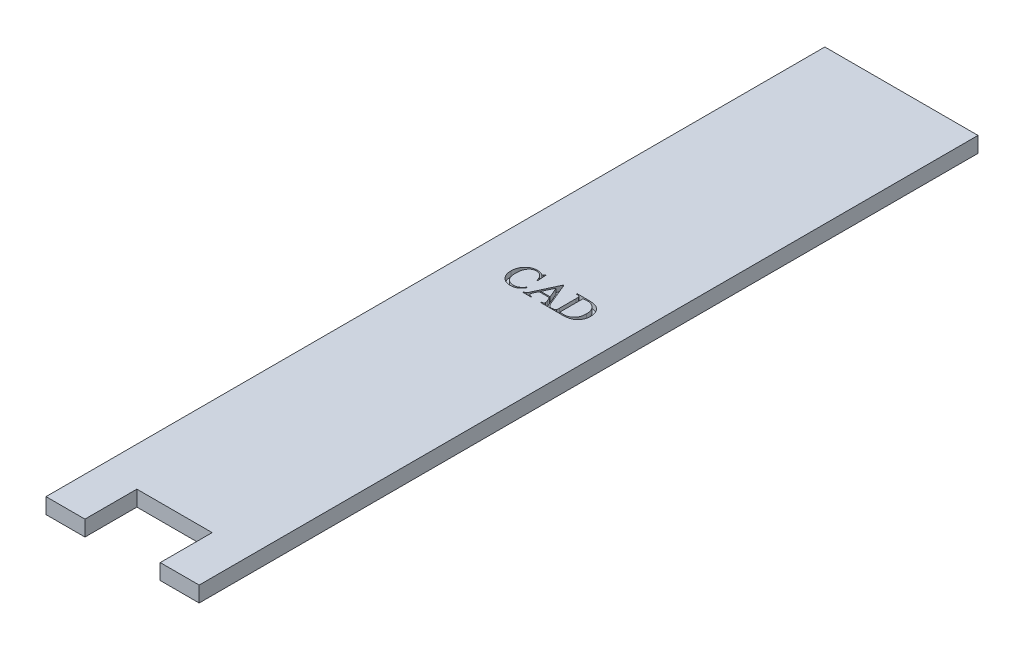
from build123d import *

# Parameters (mm, degrees)
SKETCH2_W           = 29.5
SKETCH2_H           = 3
BOSS_EXTRUDE1_DEPTH = 150
SKETCH4_W           = 14.5
SKETCH4_H           = 10
CUT_EXTRUDE2_DEPTH  = 151.753316713
CUT_EXTRUDE3_DEPTH  = 1


with BuildPart() as part:
    # Sketch2 → Boss-Extrude1 (new body)
    with BuildSketch(Plane.XY):
        Rectangle(SKETCH2_W, SKETCH2_H)
    extrude(amount=BOSS_EXTRUDE1_DEPTH)

    # Sketch4 → Cut-Extrude2 (cut, through all)
    with BuildSketch(Plane(origin=(0, 1.5, 0), x_dir=(1, 0, 0), z_dir=(0, 1, 0))):
        with Locations((0, -145)):
            Rectangle(SKETCH4_W, SKETCH4_H)
    extrude(amount=-CUT_EXTRUDE2_DEPTH, mode=Mode.SUBTRACT)

    # Sketch5 → Cut-Extrude3 (cut)
    # profile 1 of 3: a face of its own
    with BuildSketch(Plane(origin=(0, 1.5, 0), x_dir=(1, 0, 0), z_dir=(0, 1, 0))):
        with BuildLine():
            Line((-3.541666667, -64.930555556), (-3.402777778, -66.666666667))
            Line((-3.402777778, -66.666666667), (-3.541666667, -66.666666667))
            add(Edge.make_bspline(
                [(-3.541666667, -66.666666667), (-3.560127797, -66.600980352), (-3.595893554, -66.473722668), (-3.659666525, -66.291811306), (-3.72687542, -66.123377014), (-3.80227413, -65.969997245), (-3.882169582, -65.830137144), (-3.969191355, -65.705066868), (-4.061446842, -65.593640655), (-4.159647569, -65.496286724), (-4.263693084, -65.412241927), (-4.372377784, -65.339425859), (-4.485902518, -65.27702795), (-4.604543404, -65.225709679), (-4.728887016, -65.186329848), (-4.858484508, -65.160217977), (-4.992585977, -65.141460583), (-5.083844223, -65.139755276), (-5.130208333, -65.138888889)],
                knots=[0, 0, 0, 0, 1.365306606, 2.645083058, 3.856296657, 4.992683601, 6.063002854, 7.077131597, 8.038305781, 8.954596039, 9.839848101, 10.711227855, 11.569763097, 12.429061007, 13.294496621, 14.174761977, 15.072680662, 16, 16, 16, 16], degree=3))
            add(Edge.make_bspline(
                [(-5.130208333, -65.138888889), (-5.169287844, -65.139910558), (-5.246507093, -65.141929329), (-5.360883492, -65.152321387), (-5.472048479, -65.1724986), (-5.580824898, -65.198913438), (-5.686129552, -65.235816334), (-5.789791277, -65.277309199), (-5.889530348, -65.328936445), (-5.986658971, -65.387551185), (-6.079895988, -65.454629607), (-6.168442528, -65.530943886), (-6.250695552, -65.617119679), (-6.328676248, -65.712313334), (-6.400174828, -65.817665805), (-6.469732236, -65.930449664), (-6.530813132, -66.054200427), (-6.588653986, -66.186009459), (-6.639210104, -66.327178393), (-6.683765793, -66.476393122), (-6.721903181, -66.633513917), (-6.751481957, -66.799623307), (-6.777442138, -66.973509695), (-6.79218997, -67.156576464), (-6.804207347, -67.347208478), (-6.805100567, -67.477191837), (-6.805555556, -67.543402778)],
                knots=[0, 0, 0, 0, 0.852545564, 1.684589362, 2.501652392, 3.314783632, 4.123040609, 4.933143274, 5.748109165, 6.569312519, 7.405645712, 8.25016084, 9.114918083, 10.000754889, 10.930732154, 11.889927012, 12.888317242, 13.937610583, 15.028084188, 16.156171809, 17.332859433, 18.552090647, 19.835038534, 21.165583881, 22.556204723, 24, 24, 24, 24], degree=3))
            add(Edge.make_bspline(
                [(-6.805555556, -67.543402778), (-6.804946869, -67.598394167), (-6.803748531, -67.706657227), (-6.793819055, -67.865960772), (-6.777574592, -68.019837463), (-6.754944485, -68.167960309), (-6.726034828, -68.310869638), (-6.688544954, -68.447458465), (-6.646524944, -68.579136742), (-6.598146101, -68.705297159), (-6.541430788, -68.824142146), (-6.479663213, -68.937065932), (-6.410200288, -69.042195488), (-6.33376384, -69.140276131), (-6.2514189, -69.231665646), (-6.162155265, -69.315532719), (-6.066030391, -69.391643532), (-5.964210791, -69.461046143), (-5.856940358, -69.522909469), (-5.745110622, -69.57604619), (-5.629592775, -69.620455861), (-5.510746875, -69.657575406), (-5.388278397, -69.686960519), (-5.261719437, -69.707584816), (-5.131523556, -69.71948639), (-5.043426681, -69.721303906), (-4.998914931, -69.722222222)],
                knots=[0, 0, 0, 0, 1.236646645, 2.434620225, 3.588021171, 4.71542926, 5.803413575, 6.864987612, 7.89909351, 8.911178466, 9.900886288, 10.858450138, 11.803739474, 12.731186558, 13.652621421, 14.567606934, 15.482266978, 16.407285251, 17.336514176, 18.264317902, 19.188799549, 20.117565524, 21.062609844, 22.018756131, 22.998958452, 24, 24, 24, 24], degree=3))
            add(Edge.make_bspline(
                [(-4.998914931, -69.722222222), (-4.922799118, -69.72014654), (-4.773966265, -69.716087861), (-4.557884156, -69.678034426), (-4.355251978, -69.617589921), (-4.196194366, -69.545405561), (-4.074860643, -69.471162672), (-3.980806535, -69.404733728), (-3.885754729, -69.324909768), (-3.787987089, -69.233606192), (-3.688371129, -69.129781075), (-3.584882083, -69.01521972), (-3.481463369, -68.886805907), (-3.413030322, -68.796475461), (-3.377821181, -68.75)],
                knots=[0, 0, 0, 0, 1.384369864, 2.706923932, 3.979392615, 5.225429667, 5.872362172, 6.566477539, 7.319183729, 8.12964106, 9.000244434, 9.937306366, 10.938733914, 12, 12, 12, 12], degree=3))
            Line((-3.377821181, -68.75), (-3.263888889, -68.819444444))
            add(Edge.make_bspline(
                [(-3.263888889, -68.819444444), (-3.294546158, -68.871799749), (-3.354758755, -68.974628506), (-3.450927393, -69.121211872), (-3.55209564, -69.256349782), (-3.657845328, -69.380017104), (-3.765604923, -69.49438415), (-3.87846188, -69.596830925), (-3.994014584, -69.689734593), (-4.115519049, -69.770001171), (-4.240729684, -69.841220516), (-4.371892922, -69.902085536), (-4.508197793, -69.954016339), (-4.65027668, -69.996798748), (-4.79839671, -70.028918323), (-4.951989518, -70.052770644), (-5.111480349, -70.067307385), (-5.219514938, -70.068723437), (-5.274522569, -70.069444444)],
                knots=[0, 0, 0, 0, 1.164115463, 2.286388121, 3.362177995, 4.401064794, 5.407448869, 6.375280312, 7.323730291, 8.2496411, 9.166480924, 10.085577234, 11.021398032, 11.963401182, 12.930012424, 13.927332932, 14.944666635, 16, 16, 16, 16], degree=3))
            add(Edge.make_bspline(
                [(-5.274522569, -70.069444444), (-5.324096727, -70.068939471), (-5.421921899, -70.067943003), (-5.56638095, -70.056433326), (-5.706963831, -70.039400567), (-5.843346858, -70.014912775), (-5.975062745, -69.981178575), (-6.103441395, -69.944751753), (-6.226329856, -69.896739785), (-6.34551672, -69.844321543), (-6.460321814, -69.783969457), (-6.571088451, -69.716906887), (-6.67730899, -69.641755494), (-6.779457497, -69.560225499), (-6.8776781, -69.472193673), (-6.97092707, -69.375976441), (-7.061207281, -69.273730428), (-7.116361323, -69.200325416), (-7.144097222, -69.163411458)],
                knots=[0, 0, 0, 0, 1.099867591, 2.170379506, 3.21370673, 4.241732154, 5.242319988, 6.230208013, 7.200627964, 8.167156574, 9.118536317, 10.076596279, 11.038581839, 12.003776478, 12.975622664, 13.963217193, 14.975741399, 16, 16, 16, 16], degree=3))
            add(Edge.make_bspline(
                [(-7.144097222, -69.163411458), (-7.183857385, -69.106575661), (-7.26281022, -68.993715276), (-7.362425055, -68.812516444), (-7.448602812, -68.625339563), (-7.518173052, -68.429518546), (-7.572699945, -68.226745496), (-7.609753065, -68.01608727), (-7.635082512, -67.798648384), (-7.637607909, -67.650899102), (-7.638888889, -67.575954861)],
                knots=[0, 0, 0, 0, 0.983524538, 1.953011393, 2.929009533, 3.904562341, 4.897931762, 5.904535192, 6.937097918, 8, 8, 8, 8], degree=3))
            add(Edge.make_bspline(
                [(-7.638888889, -67.575954861), (-7.637679207, -67.515166637), (-7.635285467, -67.394877732), (-7.621247854, -67.216193713), (-7.596600728, -67.041425057), (-7.559908779, -66.870744685), (-7.516117843, -66.702955961), (-7.46041206, -66.539328845), (-7.395373082, -66.379442777), (-7.320272394, -66.224589715), (-7.237642662, -66.07499736), (-7.144913191, -65.934287711), (-7.04625044, -65.801160156), (-6.939602001, -65.67718208), (-6.825427191, -65.561838102), (-6.703584062, -65.455230266), (-6.574112032, -65.357363564), (-6.437727993, -65.268606031), (-6.295683506, -65.189818414), (-6.150286975, -65.119919501), (-6.001229025, -65.061224574), (-5.848947954, -65.013353248), (-5.693731323, -64.97640624), (-5.535240941, -64.950639065), (-5.373637229, -64.933554986), (-5.264438885, -64.931560496), (-5.209418403, -64.930555556)],
                knots=[0, 0, 0, 0, 1.092083487, 2.161035764, 3.217773312, 4.260190825, 5.295679875, 6.331270849, 7.362920202, 8.394590017, 9.421399, 10.430623911, 11.419565072, 12.396371527, 13.365824252, 14.332813307, 15.302266032, 16.279072486, 17.253498857, 18.218389939, 19.175218244, 20.128753647, 21.083815363, 22.038788663, 23.011827579, 24, 24, 24, 24], degree=3))
            add(Edge.make_bspline(
                [(-5.209418403, -64.930555556), (-5.123169974, -64.93296225), (-4.950105444, -64.937791479), (-4.692543025, -64.980230408), (-4.436087364, -65.04531662), (-4.270952685, -65.110302442), (-4.187282986, -65.143229167)],
                knots=[0, 0, 0, 0, 0.984356359, 1.975191602, 2.974079167, 4, 4, 4, 4], degree=3))
            add(Edge.make_bspline(
                [(-4.187282986, -65.143229167), (-4.164592539, -65.15288801), (-4.122843604, -65.170659648), (-4.064997545, -65.191216313), (-4.017502596, -65.204648799), (-3.98913298, -65.207215619), (-3.976779514, -65.208333333)],
                knots=[0, 0, 0, 0, 1.336236462, 2.458587416, 3.328796419, 4, 4, 4, 4], degree=3))
            add(Edge.make_bspline(
                [(-3.976779514, -65.208333333), (-3.94627596, -65.206100199), (-3.886010248, -65.201688208), (-3.835639453, -65.168365906), (-3.810763889, -65.151909722)],
                knots=[0, 0, 0, 0, 1.012302122, 2, 2, 2, 2], degree=3))
            add(Edge.make_bspline(
                [(-3.810763889, -65.151909722), (-3.79608402, -65.137934705), (-3.766097958, -65.109388419), (-3.731233143, -65.056311585), (-3.700766592, -64.99687859), (-3.68747169, -64.953251028), (-3.680555556, -64.930555556)],
                knots=[0, 0, 0, 0, 0.931295945, 1.90232619, 2.908770141, 4, 4, 4, 4], degree=3))
            Line((-3.680555556, -64.930555556), (-3.541666667, -64.930555556))
        make_face()
    # profile 2 of 3: a face of its own
    with BuildSketch(Plane(origin=(0, 1.5, 0), x_dir=(1, 0, 0), z_dir=(0, 1, 0))):
        with BuildLine():
            Line((0.553385417, -68.333333333), (-1.439887153, -68.333333333))
            Line((-1.439887153, -68.333333333), (-1.805555556, -69.12109375))
            add(Edge.make_bspline(
                [(-1.805555556, -69.12109375), (-1.824230869, -69.165729674), (-1.858675129, -69.248055002), (-1.897877851, -69.364643338), (-1.924655467, -69.46314812), (-1.928595018, -69.523896077), (-1.930338542, -69.55078125)],
                knots=[0, 0, 0, 0, 1.290094603, 2.37941668, 3.282779777, 4, 4, 4, 4], degree=3))
            add(Edge.make_bspline(
                [(-1.930338542, -69.55078125), (-1.92925002, -69.569455347), (-1.927086893, -69.606564783), (-1.904089803, -69.659399642), (-1.870066397, -69.708537861), (-1.830963184, -69.746254411), (-1.790534833, -69.772553804), (-1.751595142, -69.79126114), (-1.704562511, -69.807258867), (-1.649556642, -69.82063472), (-1.586981319, -69.833801737), (-1.51688411, -69.846063363), (-1.438509503, -69.853943293), (-1.383829045, -69.858650837), (-1.355251736, -69.861111111)],
                knots=[0, 0, 0, 0, 0.928346294, 1.844823155, 2.832693264, 3.906787277, 4.533555799, 5.236980931, 6.060283213, 7.011752617, 8.064797478, 9.256587662, 10.566227436, 12, 12, 12, 12], degree=3))
            Line((-1.355251736, -69.861111111), (-1.355251736, -70))
            Line((-1.355251736, -70), (-2.925347222, -70))
            Line((-2.925347222, -70), (-2.925347222, -69.861111111))
            add(Edge.make_bspline(
                [(-2.925347222, -69.861111111), (-2.87777174, -69.851358363), (-2.791273973, -69.83362673), (-2.676142756, -69.799548874), (-2.58668341, -69.7617441), (-2.542172289, -69.726654168), (-2.522786458, -69.711371528)],
                knots=[0, 0, 0, 0, 1.341417684, 2.438853554, 3.320077337, 4, 4, 4, 4], degree=3))
            add(Edge.make_bspline(
                [(-2.522786458, -69.711371528), (-2.50658002, -69.694265896), (-2.472102733, -69.657875681), (-2.423141844, -69.593915368), (-2.373699828, -69.517796313), (-2.323078756, -69.429915669), (-2.270790897, -69.330290907), (-2.216817202, -69.219383297), (-2.162536998, -69.095668179), (-2.126914148, -69.009046129), (-2.108289931, -68.963758681)],
                knots=[0, 0, 0, 0, 0.657509844, 1.398774721, 2.244567789, 3.190193186, 4.229071695, 5.385194885, 6.63293641, 8, 8, 8, 8], degree=3))
            Line((-2.108289931, -68.963758681), (-0.233289931, -64.930555556))
            Line((-0.233289931, -64.930555556), (-0.096571181, -64.930555556))
            Line((-0.096571181, -64.930555556), (1.597222222, -69.051649306))
            add(Edge.make_bspline(
                [(1.597222222, -69.051649306), (1.613860368, -69.091236776), (1.645859565, -69.1673731), (1.697738836, -69.274457246), (1.745503316, -69.372162995), (1.793519951, -69.458225424), (1.839955181, -69.533385139), (1.885412105, -69.597701992), (1.929683964, -69.651433318), (1.988010143, -69.708454914), (2.069103635, -69.76614468), (2.182244256, -69.814002935), (2.310467224, -69.848409375), (2.402112277, -69.856746682), (2.450086806, -69.861111111)],
                knots=[0, 0, 0, 0, 1.223989839, 2.354029848, 3.391605643, 4.324042249, 5.162387765, 5.909171864, 6.567979791, 7.144041755, 8.231258465, 9.380841669, 10.628917946, 12, 12, 12, 12], degree=3))
            Line((2.450086806, -69.861111111), (2.450086806, -70))
            Line((2.450086806, -70), (0.476345486, -70))
            Line((0.476345486, -70), (0.476345486, -69.861111111))
            add(Edge.make_bspline(
                [(0.476345486, -69.861111111), (0.522049976, -69.858175632), (0.606024478, -69.85278217), (0.719030328, -69.830961727), (0.809780901, -69.803849814), (0.876855371, -69.763542026), (0.924319725, -69.715947633), (0.957621621, -69.664136703), (0.978422108, -69.607266965), (0.980790299, -69.567589944), (0.981987847, -69.547526042)],
                knots=[0, 0, 0, 0, 1.654818352, 3.040457217, 4.157564338, 5.061856313, 5.838989301, 6.56851638, 7.276126429, 8, 8, 8, 8], degree=3))
            add(Edge.make_bspline(
                [(0.981987847, -69.547526042), (0.980038239, -69.515553744), (0.975594755, -69.442683508), (0.943177106, -69.323134952), (0.898558521, -69.178992697), (0.857661232, -69.076692585), (0.835503472, -69.021267361)],
                knots=[0, 0, 0, 0, 0.698820548, 1.592729354, 2.695763756, 4, 4, 4, 4], degree=3))
            Line((0.835503472, -69.021267361), (0.553385417, -68.333333333))
        make_face()
        Polygon((0.467664931, -68.125), (-0.381944444, -66.117621528), (-1.343315972, -68.125), align=None, mode=Mode.SUBTRACT)
    # profile 3 of 3: a face of its own
    with BuildSketch(Plane(origin=(0, 1.5, 0), x_dir=(1, 0, 0), z_dir=(0, 1, 0))):
        with BuildLine():
            Line((2.569444444, -70), (2.569444444, -69.861111111))
            Line((2.569444444, -69.861111111), (2.750651042, -69.861111111))
            add(Edge.make_bspline(
                [(2.750651042, -69.861111111), (2.775279414, -69.860529864), (2.822934507, -69.85940517), (2.891719334, -69.849535698), (2.955082596, -69.833332974), (3.013066457, -69.810961284), (3.064518238, -69.780578318), (3.112167037, -69.746429791), (3.152665345, -69.703229963), (3.174633003, -69.670464778), (3.185763889, -69.653862847)],
                knots=[0, 0, 0, 0, 1.170016541, 2.263943595, 3.293731011, 4.273677885, 5.205400736, 6.126759273, 7.050839703, 8, 8, 8, 8], degree=3))
            add(Edge.make_bspline(
                [(3.185763889, -69.653862847), (3.192233993, -69.642076262), (3.206477371, -69.616129105), (3.222184583, -69.56998712), (3.234544886, -69.514603974), (3.245515106, -69.449769745), (3.253685032, -69.375492268), (3.260519051, -69.29120286), (3.263219646, -69.197427809), (3.263659404, -69.131582943), (3.263888889, -69.097222222)],
                knots=[0, 0, 0, 0, 0.568141805, 1.250715472, 2.052584266, 2.968455247, 4.031571596, 5.213625719, 6.545948453, 8, 8, 8, 8], degree=3))
            Line((3.263888889, -69.097222222), (3.263888889, -65.902777778))
            add(Edge.make_bspline(
                [(3.263888889, -65.902777778), (3.263939844, -65.864788426), (3.264036478, -65.792743026), (3.257815317, -65.690025344), (3.251005434, -65.598354227), (3.240368143, -65.517897601), (3.226502492, -65.448496253), (3.209226597, -65.390587005), (3.190986458, -65.341878579), (3.172541565, -65.316548622), (3.1640625, -65.304904514)],
                knots=[0, 0, 0, 0, 1.484107705, 2.814555366, 4.019988359, 5.075390106, 5.984573864, 6.780592097, 7.4394417, 8, 8, 8, 8], degree=3))
            add(Edge.make_bspline(
                [(3.1640625, -65.304904514), (3.139179083, -65.279230899), (3.08915632, -65.227619613), (2.99050509, -65.175036042), (2.875796819, -65.144715416), (2.793897101, -65.140902335), (2.750651042, -65.138888889)],
                knots=[0, 0, 0, 0, 0.928124107, 1.865794122, 2.873060895, 4, 4, 4, 4], degree=3))
            Line((2.750651042, -65.138888889), (2.569444444, -65.138888889))
            Line((2.569444444, -65.138888889), (2.569444444, -65))
            Line((2.569444444, -65), (4.618055556, -65))
            add(Edge.make_bspline(
                [(4.618055556, -65), (4.709215818, -65.000856714), (4.886191622, -65.002519913), (5.143131079, -65.014631671), (5.383558185, -65.033487965), (5.606593673, -65.061479717), (5.81297945, -65.097380038), (6.002805026, -65.139818534), (6.175757832, -65.191779617), (6.333132195, -65.252088016), (6.478950498, -65.321197973), (6.615342431, -65.401788956), (6.74488344, -65.492045493), (6.867563969, -65.592488813), (6.982057595, -65.70441724), (7.090192138, -65.826319444), (7.189959838, -65.959582647), (7.282847513, -66.101771721), (7.366406443, -66.252560459), (7.439022795, -66.410060835), (7.500936181, -66.573233014), (7.552365307, -66.742005237), (7.591410844, -66.916871488), (7.617611172, -67.097566876), (7.636297706, -67.283682525), (7.638016417, -67.409890994), (7.638888889, -67.473958333)],
                knots=[0, 0, 0, 0, 1.467398357, 2.848763231, 4.139747069, 5.348651221, 6.465709142, 7.510884705, 8.477890948, 9.369935066, 10.221521294, 11.072291092, 11.917022873, 12.760911509, 13.621447043, 14.491775058, 15.381421868, 16.298684439, 17.223858558, 18.153856654, 19.088127867, 20.031156851, 20.991691223, 21.969088183, 22.969046064, 24, 24, 24, 24], degree=3))
            add(Edge.make_bspline(
                [(7.638888889, -67.473958333), (7.637206894, -67.559416332), (7.633910105, -67.726917932), (7.602258339, -67.97264244), (7.552818592, -68.207639557), (7.483441138, -68.43244434), (7.392924594, -68.646043736), (7.282238983, -68.848705047), (7.154063172, -69.042505258), (7.05213786, -69.159766178), (7.000868056, -69.21875)],
                knots=[0, 0, 0, 0, 1.077719575, 2.112379846, 3.120154608, 4.104514829, 5.075810074, 6.041644454, 7.014920789, 8, 8, 8, 8], degree=3))
            add(Edge.make_bspline(
                [(7.000868056, -69.21875), (6.970538358, -69.25063665), (6.909663439, -69.314636537), (6.810744866, -69.403120651), (6.706475699, -69.485863225), (6.596150824, -69.562111748), (6.480273609, -69.632507415), (6.358293029, -69.696960707), (6.229963595, -69.753910891), (6.096591667, -69.806400426), (5.956931753, -69.851740042), (5.811844638, -69.891968111), (5.660470902, -69.925711806), (5.503191717, -69.952275992), (5.340393619, -69.9743042), (5.171679171, -69.989344896), (4.997196497, -69.997898824), (4.878843233, -69.999292752), (4.818793403, -70)],
                knots=[0, 0, 0, 0, 0.884547214, 1.775380039, 2.665826882, 3.559504879, 4.469980105, 5.390593375, 6.331323642, 7.291529335, 8.271228182, 9.282197471, 10.317896576, 11.387954191, 12.488469157, 13.620281033, 14.792583212, 16, 16, 16, 16], degree=3))
            Line((4.818793403, -70), (2.569444444, -70))
        make_face()
        with BuildLine():
            add(Edge.make_bspline(
                [(3.958333333, -69.685329861), (4.035221917, -69.701726198), (4.181921261, -69.73300954), (4.393972778, -69.764555583), (4.586085249, -69.787635915), (4.708058188, -69.790374265), (4.765625, -69.791666667)],
                knots=[0, 0, 0, 0, 1.156263879, 2.206090244, 3.153339526, 4, 4, 4, 4], degree=3))
            add(Edge.make_bspline(
                [(4.765625, -69.791666667), (4.83734737, -69.789878083), (4.978513977, -69.786357726), (5.185234016, -69.755972947), (5.383178125, -69.708624392), (5.571739606, -69.641135072), (5.750746707, -69.553797926), (5.919997702, -69.446846287), (6.078681198, -69.319587423), (6.228598684, -69.176196764), (6.363423151, -69.014680964), (6.482823049, -68.839219385), (6.582726881, -68.649403913), (6.664236379, -68.446001135), (6.72848522, -68.22918978), (6.773471295, -67.998128811), (6.801105547, -67.753497396), (6.80404946, -67.585795628), (6.805555556, -67.5)],
                knots=[0, 0, 0, 0, 0.997996022, 1.964292496, 2.902202989, 3.827540679, 4.746320531, 5.669683403, 6.608607029, 7.573643287, 8.552931756, 9.531909504, 10.522958759, 11.532773866, 12.577887131, 13.666093008, 14.805981493, 16, 16, 16, 16], degree=3))
            add(Edge.make_bspline(
                [(6.805555556, -67.5), (6.804052965, -67.413482255), (6.801121648, -67.244699793), (6.773594595, -66.998960075), (6.728328192, -66.767235485), (6.664223691, -66.549686225), (6.582945968, -66.345447176), (6.483069847, -66.155554769), (6.363449682, -65.980888908), (6.22814677, -65.820613318), (6.078871145, -65.676405353), (5.917650566, -65.550958829), (5.745816666, -65.445052146), (5.56406163, -65.357098169), (5.370423208, -65.291989705), (5.168126341, -65.242138045), (4.954853474, -65.21404386), (4.80946801, -65.210263404), (4.735243056, -65.208333333)],
                knots=[0, 0, 0, 0, 1.193396302, 2.328127765, 3.406675227, 4.447298146, 5.452780722, 6.435033879, 7.401194227, 8.367973033, 9.324444072, 10.259799173, 11.180785527, 12.104889921, 13.03919269, 13.994204462, 14.975963072, 16, 16, 16, 16], degree=3))
            add(Edge.make_bspline(
                [(4.735243056, -65.208333333), (4.67659607, -65.209622571), (4.554626865, -65.212303822), (4.366166158, -65.234232467), (4.165586717, -65.269202457), (4.029074854, -65.301294828), (3.958333333, -65.317925347)],
                knots=[0, 0, 0, 0, 0.894670856, 1.860663297, 2.891378894, 4, 4, 4, 4], degree=3))
            Line((3.958333333, -65.317925347), (3.958333333, -69.685329861))
        make_face(mode=Mode.SUBTRACT)
    extrude(amount=-CUT_EXTRUDE3_DEPTH, mode=Mode.SUBTRACT)


solid = part.part
